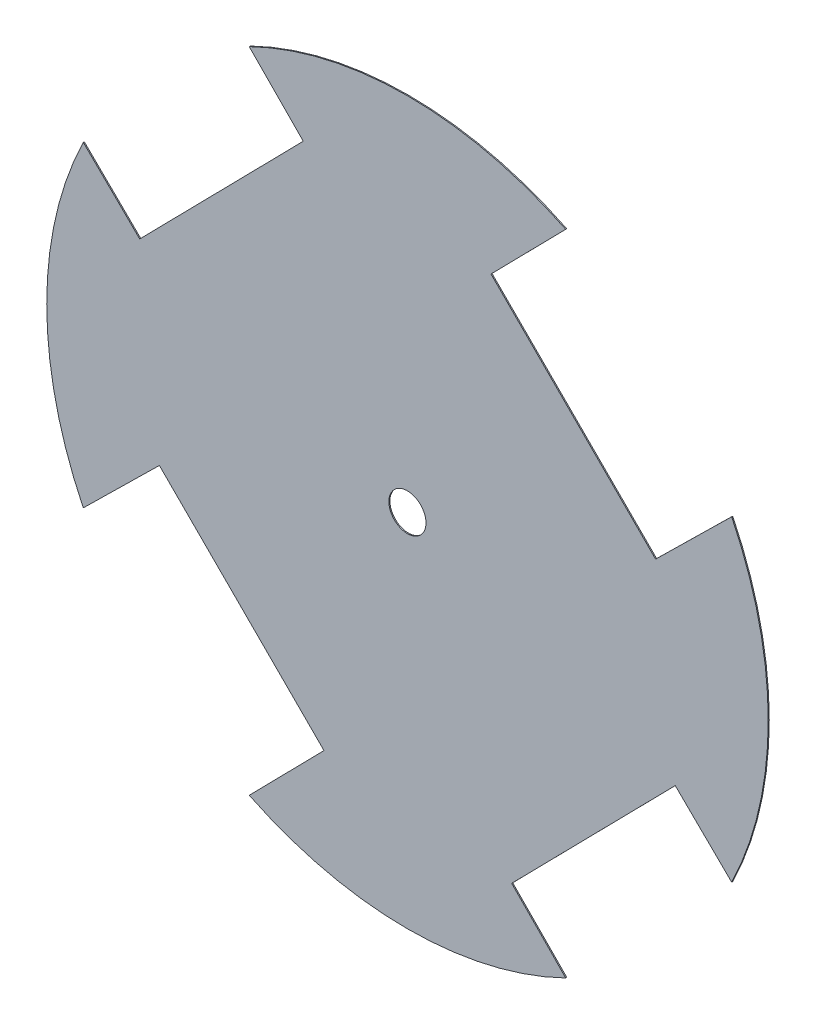
from build123d import *

# Parameters (mm, degrees)
BOSS_EXTRUDE1_DEPTH = 5
SKETCH3_R           = 90
CUT_EXTRUDE3_DEPTH  = 10


with BuildPart() as part:
    # Sketch2 → Boss-Extrude1 (new body)
    with BuildSketch(Plane.XY):
        with BuildLine():
            Line((767.947915583, -1572.625771149), (505.906479137, -1305.981517926))
            Line((505.906479137, -1305.981517926), (1299.211324809, -498.742094189))
            Line((1299.211324809, -498.742094189), (1572.883525326, -767.690161406))
            ThreePointArc((1572.883525326, -767.690161406), (1750.257754177, 0), (1572.883525326, 767.690161406))
            Line((1572.883525326, 767.690161406), (1203.829573729, 405.006824211))
            Line((1203.829573729, 405.006824211), (405.264578388, 1203.571819552))
            Line((405.264578388, 1203.571819552), (767.947915583, 1572.625771149))
            ThreePointArc((767.947915583, 1572.625771149), (0.257754177, 1750), (-767.432407229, 1572.625771149))
            Line((-767.432407229, 1572.625771149), (-505.390970783, 1305.981517926))
            Line((-505.390970783, 1305.981517926), (-1298.695816455, 498.742094189))
            Line((-1298.695816455, 498.742094189), (-1572.368016972, 767.690161406))
            ThreePointArc((-1572.368016972, 767.690161406), (-1749.742245823, 0), (-1572.368016972, -767.690161406))
            Line((-1572.368016972, -767.690161406), (-1203.314065375, -405.006824211))
            Line((-1203.314065375, -405.006824211), (-404.749070034, -1203.571819552))
            Line((-404.749070034, -1203.571819552), (-767.432407229, -1572.625771149))
            ThreePointArc((-767.432407229, -1572.625771149), (0.257754177, -1750), (767.947915583, -1572.625771149))
        make_face()
    extrude(amount=BOSS_EXTRUDE1_DEPTH)

    # Sketch3 → Cut-Extrude3 (cut)
    with BuildSketch(Plane.XY):
        Circle(SKETCH3_R)
    extrude(amount=CUT_EXTRUDE3_DEPTH, mode=Mode.SUBTRACT)


solid = part.part
